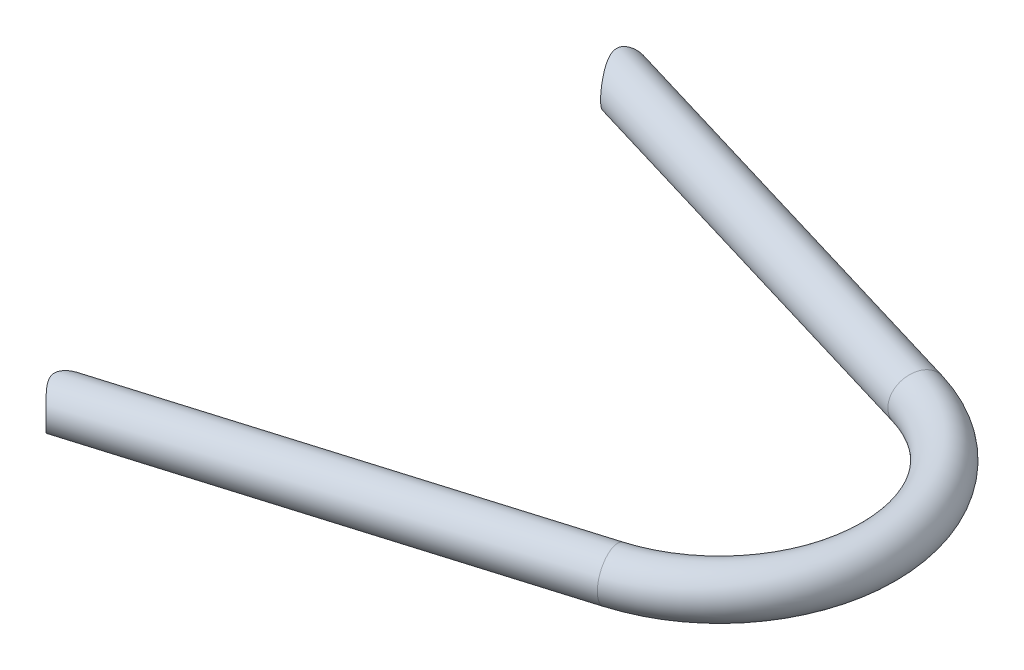
from build123d import *

# Parameters (mm, degrees)
SWEEP_THIN1_PROFILE_R   = 7.5
SWEEP_THIN1_PROFILE_R_2 = 5
CUT_EXTRUDE2_DEPTH      = 208.777034922
CUT_EXTRUDE2_DEPTH_BACK = 208.777034922
SKETCH34_R              = 9


with BuildPart() as part:
    # Sweep-Thin1: sweep along a path in Sketch1
    with BuildLine(Plane(origin=(0, 0, 0), x_dir=(1, 0, 0), z_dir=(0, 1, 0))) as sweep_thin1_path:
        Line((0, 90), (140.362285796, 47.891314261))
        ThreePointArc((140.362285796, 47.891314261), (175.994891518, 0), (140.362285796, -47.891314261))
        Line((140.362285796, -47.891314261), (0, -90))
    # Sweep-Thin1 profile (on start of the path) → Sweep-Thin1 (sweep)
    with BuildSketch(Plane(origin=(0, 0, -90), x_dir=(-0.2873478855663455, 0, 0.9578262852211514), z_dir=(0.9578262852211514, 0, 0.2873478855663455))):
        Circle(SWEEP_THIN1_PROFILE_R)
        Circle(SWEEP_THIN1_PROFILE_R_2, mode=Mode.SUBTRACT)
    sweep(path=sweep_thin1_path.line)

    # Sketch34 → Cut-Extrude2 (cut, two sides: drawn at the far end of the back side and taken through both)
    with BuildSketch(Plane.XY.offset(-CUT_EXTRUDE2_DEPTH_BACK)):
        Circle(SKETCH34_R)
    extrude(amount=CUT_EXTRUDE2_DEPTH + CUT_EXTRUDE2_DEPTH_BACK, mode=Mode.SUBTRACT)


solid = part.part
